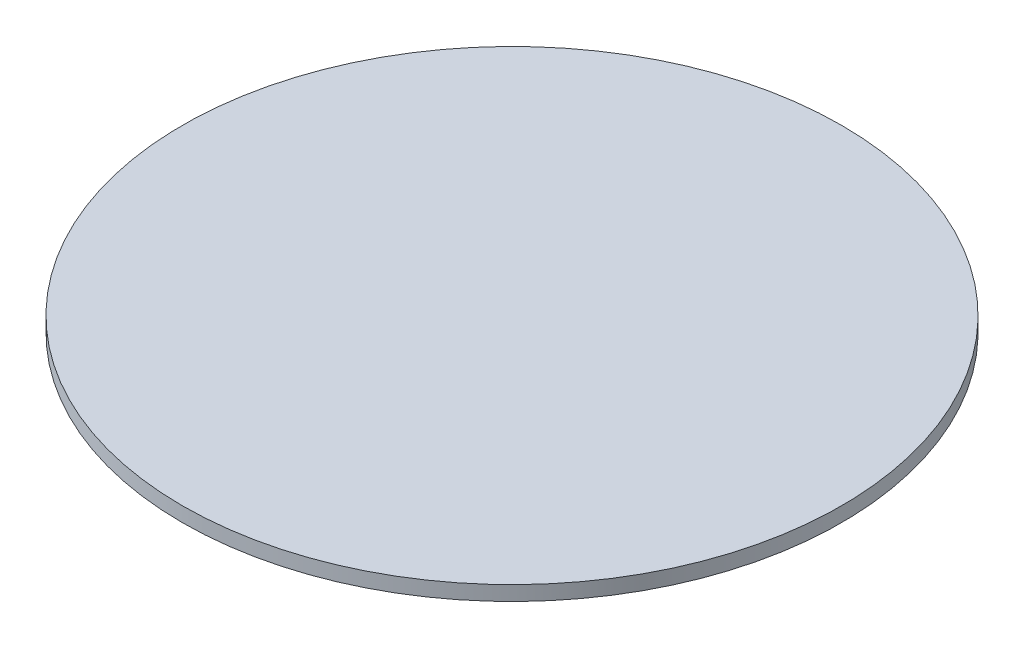
from build123d import *

# Parameters (mm, degrees)
SKETCH2_R           = 45
BOSS_EXTRUDE1_DEPTH = 2


with BuildPart() as part:
    # Sketch2 → Boss-Extrude1 (new body)
    with BuildSketch(Plane(origin=(0, 0, 0), x_dir=(1, 0, 0), z_dir=(0, 1, 0))):
        with Locations(Location((0, 0, 0), (0, 0, 270))):
            Circle(SKETCH2_R)
    extrude(amount=BOSS_EXTRUDE1_DEPTH)


solid = part.part
